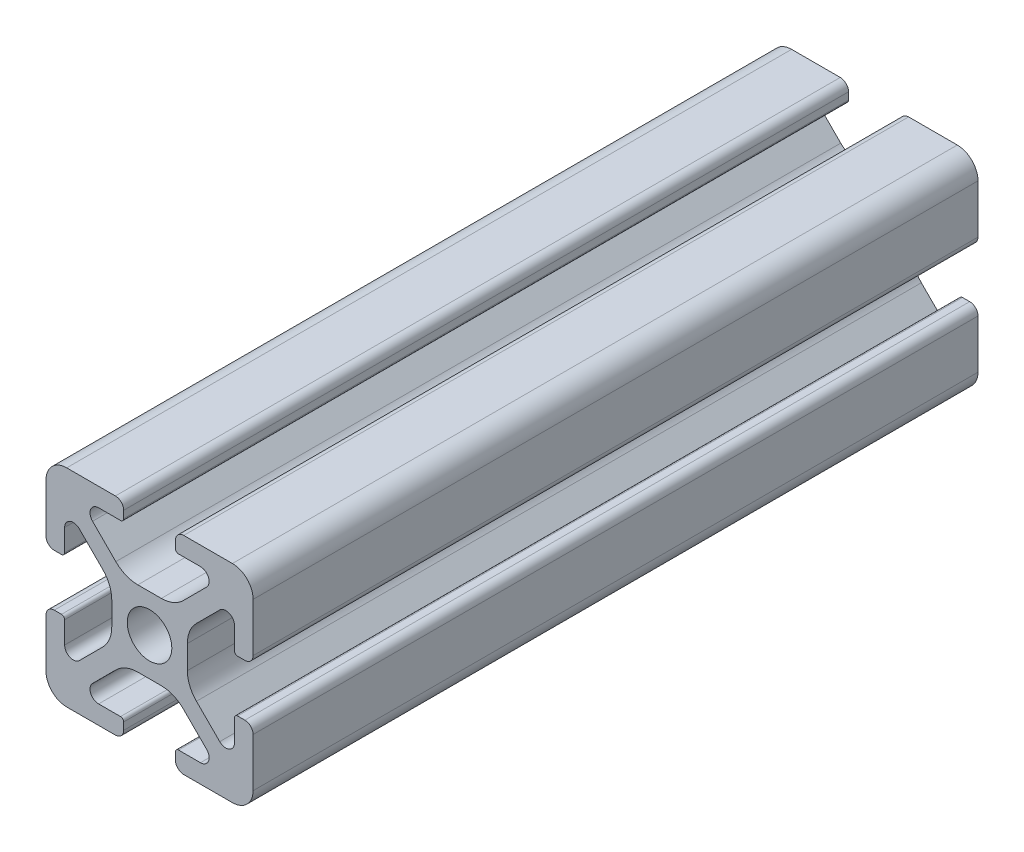
from build123d import *

# Parameters (mm, degrees)
ESQUISSE1_R        = 2.15
BOSS_EXTRU_1_DEPTH = 35


with BuildPart() as part:
    # Esquisse1 → Boss.-Extru.1 (new, symmetric)
    with BuildSketch(Plane(origin=(0, 0, 0), x_dir=(-1, 0, 0), z_dir=(0, 0, -1))):
        with BuildLine():
            Line((-12.499999997, 0.800000003), (-12.499999998, 1.500000003))
            ThreePointArc((-12.499999998, 1.500000003), (-12.587867964, 1.712132039), (-12.8, 1.800000005))
            Line((-12.8, 1.800000005), (-14.9175884, 1.800000005))
            ThreePointArc((-14.9175884, 1.800000005), (-15.686636444, 2.31386148), (-15.50619229, 3.2210155))
            Line((-15.50619229, 3.2210155), (-13.25588745, 5.47132034))
            ThreePointArc((-13.25588745, 5.47132034), (-12.282617404, 6.121638593), (-11.134567108, 6.349999996))
            Line((-11.134567108, 6.349999996), (-8.865432907, 6.349999996))
            ThreePointArc((-8.865432907, 6.349999996), (-7.717382611, 6.121638594), (-6.744112567, 5.471320341))
            Line((-6.744112567, 5.471320341), (-4.493807729, 3.221015503))
            ThreePointArc((-4.493807729, 3.221015503), (-4.313363575, 2.313861481), (-5.082411621, 1.800000005))
            Line((-5.082411621, 1.800000005), (-7.20000001, 1.800000005))
            ThreePointArc((-7.20000001, 1.800000005), (-7.412132045, 1.71213204), (-7.50000001, 1.500000005))
            Line((-7.50000001, 1.500000005), (-7.50000001, 0.8))
            ThreePointArc((-7.50000001, 0.8), (-7.265685435, 0.234314575), (-6.70000001, 0))
            Line((-6.70000001, 0), (-2, 0))
            ThreePointArc((-2, 0), (-0.585786438, 0.585786438), (0, 2))
            Line((0, 2), (0, 6.699999998))
            ThreePointArc((0, 6.699999998), (-0.234314576, 7.265685424), (-0.800000003, 7.5))
            Line((-0.800000003, 7.5), (-1.50000001, 7.5))
            ThreePointArc((-1.50000001, 7.5), (-1.712132046, 7.412132033), (-1.800000013, 7.199999997))
            Line((-1.800000013, 7.199999997), (-1.800000013, 5.082411603))
            ThreePointArc((-1.800000013, 5.082411603), (-2.313861487, 4.31336356), (-3.221015507, 4.493807713))
            Line((-3.221015507, 4.493807713), (-5.471320347, 6.744112553))
            ThreePointArc((-5.471320347, 6.744112553), (-6.1216386, 7.717382599), (-6.350000003, 8.865432896))
            Line((-6.350000003, 8.865432896), (-6.350000003, 11.134567102))
            ThreePointArc((-6.350000003, 11.134567102), (-6.121638601, 12.282617397), (-5.471320348, 13.255887442))
            Line((-5.471320348, 13.255887442), (-3.221015512, 15.506192278))
            ThreePointArc((-3.221015512, 15.506192278), (-2.313861489, 15.686636432), (-1.800000013, 14.917588386))
            Line((-1.800000013, 14.917588386), (-1.800000013, 12.799999998))
            ThreePointArc((-1.800000013, 12.799999998), (-1.712132047, 12.587867963), (-1.500000013, 12.499999997))
            Line((-1.500000013, 12.499999997), (-0.8, 12.499999997))
            ThreePointArc((-0.8, 12.499999997), (-0.234314575, 12.734314573), (0, 13.299999998))
            Line((0, 13.299999998), (0, 18))
            ThreePointArc((0, 18), (-0.585786438, 19.414213562), (-2, 20))
            Line((-2, 20), (-6.700000008, 20))
            ThreePointArc((-6.700000008, 20), (-7.265685435, 19.765685424), (-7.50000001, 19.199999998))
            Line((-7.50000001, 19.199999998), (-7.50000001, 18.500000005))
            ThreePointArc((-7.50000001, 18.500000005), (-7.412132044, 18.287867969), (-7.200000008, 18.200000003))
            Line((-7.200000008, 18.200000003), (-5.082411594, 18.200000003))
            ThreePointArc((-5.082411594, 18.200000003), (-4.313363546, 17.686138526), (-4.493807701, 16.778984501))
            Line((-4.493807701, 16.778984501), (-6.744112542, 14.528679659))
            ThreePointArc((-6.744112542, 14.528679659), (-7.717382588, 13.878361406), (-8.865432885, 13.650000003))
            Line((-8.865432885, 13.650000003), (-11.134567112, 13.650000003))
            ThreePointArc((-11.134567112, 13.650000003), (-12.282617407, 13.878361405), (-13.255887452, 14.528679658))
            Line((-13.255887452, 14.528679658), (-15.506192292, 16.778984498))
            ThreePointArc((-15.506192292, 16.778984498), (-15.686636447, 17.686138525), (-14.917588397, 18.200000002))
            Line((-14.917588397, 18.200000002), (-12.799999998, 18.200000003))
            ThreePointArc((-12.799999998, 18.200000003), (-12.587867963, 18.287867968), (-12.499999997, 18.500000002))
            Line((-12.499999997, 18.500000002), (-12.499999997, 19.2))
            ThreePointArc((-12.499999997, 19.2), (-12.734314573, 19.765685425), (-13.299999998, 20))
            Line((-13.299999998, 20), (-18, 20))
            ThreePointArc((-18, 20), (-19.414213562, 19.414213562), (-20, 18))
            Line((-20, 18), (-20, 13.3))
            ThreePointArc((-20, 13.3), (-19.765685424, 12.734314573), (-19.199999998, 12.499999997))
            Line((-19.199999998, 12.499999997), (-18.500000003, 12.499999997))
            ThreePointArc((-18.500000003, 12.499999997), (-18.287867967, 12.587867964), (-18.2, 12.8))
            Line((-18.2, 12.8), (-18.2, 14.91758839))
            ThreePointArc((-18.2, 14.91758839), (-17.686138526, 15.686636434), (-16.778984506, 15.50619228))
            Line((-16.778984506, 15.50619228), (-14.528679657, 13.255887431))
            ThreePointArc((-14.528679657, 13.255887431), (-13.878361403, 12.282617385), (-13.650000001, 11.134567088))
            Line((-13.650000001, 11.134567088), (-13.650000001, 8.865432886))
            ThreePointArc((-13.650000001, 8.865432886), (-13.878361403, 7.717382591), (-14.528679656, 6.744112546))
            Line((-14.528679656, 6.744112546), (-16.778984496, 4.493807706))
            ThreePointArc((-16.778984496, 4.493807706), (-17.686138522, 4.313363551), (-18.2, 5.0824116))
            Line((-18.2, 5.0824116), (-18.2, 7.2))
            ThreePointArc((-18.2, 7.2), (-18.287867966, 7.412132034), (-18.5, 7.5))
            Line((-18.5, 7.5), (-19.2, 7.5))
            ThreePointArc((-19.2, 7.5), (-19.765685425, 7.265685425), (-20, 6.7))
            Line((-20, 6.7), (-20, 2))
            ThreePointArc((-20, 2), (-19.414213562, 0.585786438), (-18, 0))
            Line((-18, 0), (-13.3, 0))
            ThreePointArc((-13.3, 0), (-12.734314573, 0.234314576), (-12.499999997, 0.800000003))
        make_face()
        with Locations(Location((-10, 10, 0), (0, 0, 180))):
            Circle(ESQUISSE1_R, mode=Mode.SUBTRACT)
    extrude(amount=BOSS_EXTRU_1_DEPTH, both=True)


solid = part.part
